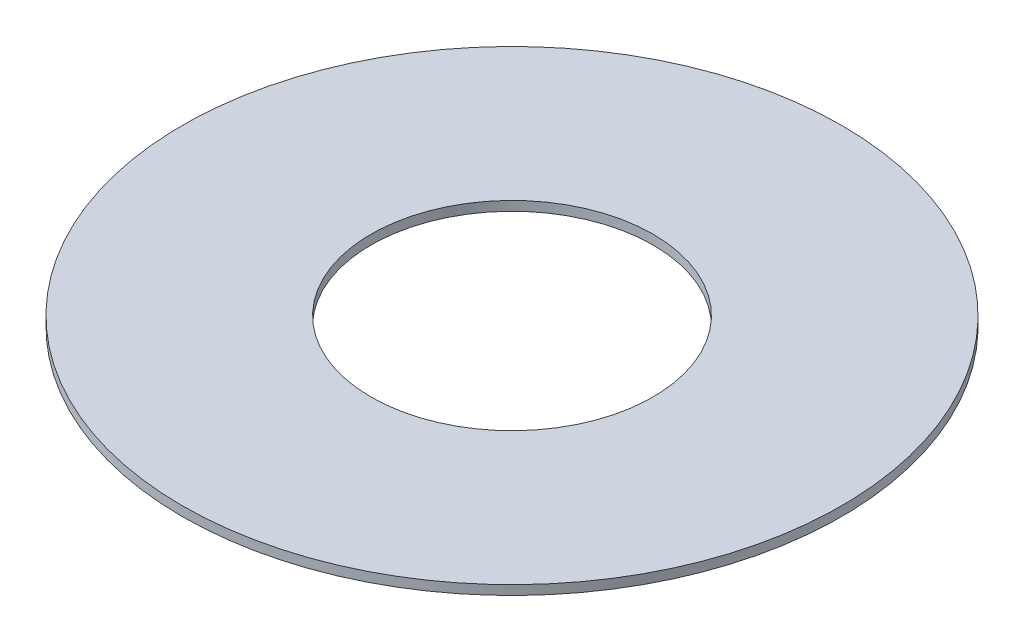
from build123d import *

# Parameters (mm, degrees)
SKETCH_1_R      = 3.505
SKETCH_1_R_2    = 1.5
EXTRUDE_1_DEPTH = 0.1


with BuildPart() as part:
    # 草图1 → 凸台-拉伸1 (new body)
    with BuildSketch(Plane(origin=(0, 0, 0), x_dir=(1, 0, 0), z_dir=(0, 1, 0))):
        with Locations(Location((0, 0, 0), (0, 0, 270))):
            Circle(SKETCH_1_R)
        with Locations(Location((0, 0, 0), (0, 0, 270))):
            Circle(SKETCH_1_R_2, mode=Mode.SUBTRACT)
    extrude(amount=EXTRUDE_1_DEPTH)


solid = part.part
